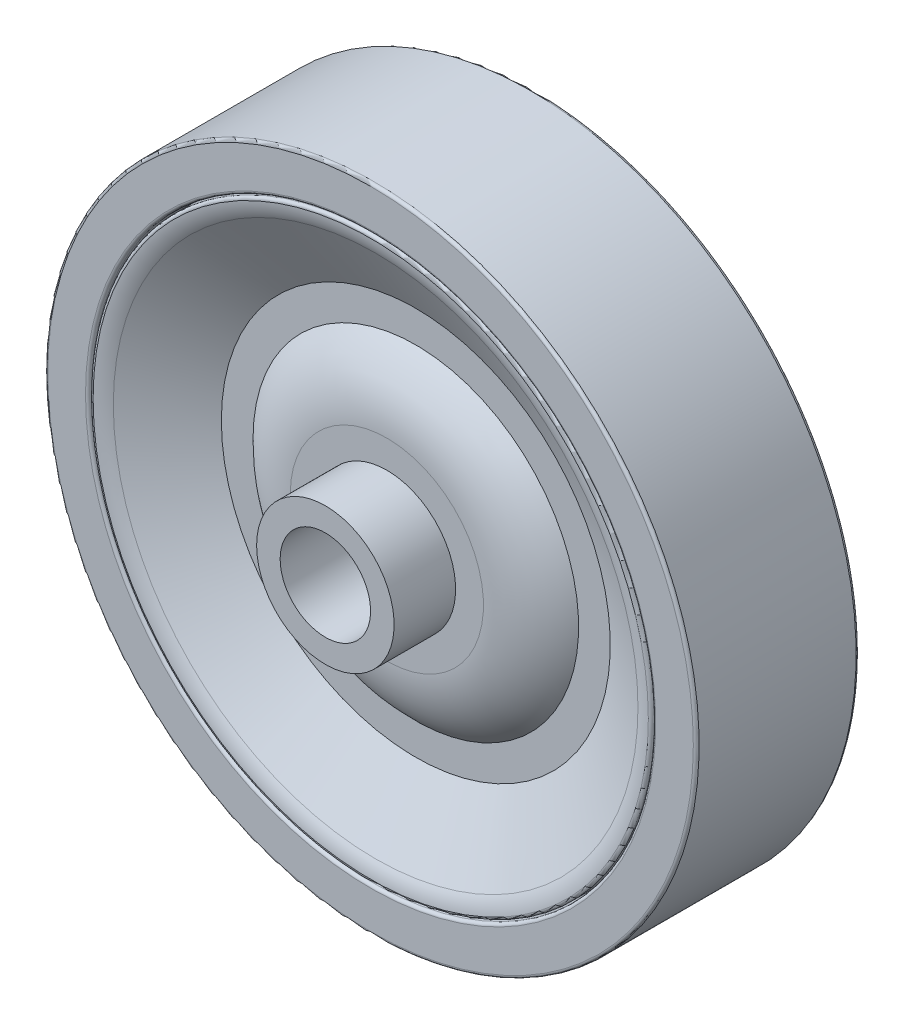
from build123d import *

# Parameters (mm, degrees)
FILLET1_R               = 0.254
CUT_EXTRUDE1_DEPTH      = 45.343566836
CUT_EXTRUDE1_DEPTH_BACK = 45.343566836
SKETCH2_R               = 24.765
SKETCH2_R_2             = 24.638


with BuildPart() as part:
    # Sketch1 → Revolve1 (revolve)
    with BuildSketch(Plane(origin=(0, 0, 0), x_dir=(0, 0, -1), z_dir=(1, 0, 0))):
        with BuildLine():
            Line((0, 28.575), (7.14375, 28.575))
            Line((7.14375, 28.575), (7.14375, 24.765))
            Line((7.14375, 24.765), (4.60375, 24.765))
            Line((4.60375, 24.765), (4.60375, 24.638))
            Line((4.60375, 24.638), (7.14375, 24.638))
            ThreePointArc((7.14375, 24.638), (7.031004143, 23.799415143), (6.700773898, 23.020387432))
            Line((6.700773898, 23.020387432), (3.175, 17.065625))
            Line((3.175, 17.065625), (3.175, 14.2875))
            ThreePointArc((3.175, 14.2875), (5.05226622, 11.647141084), (5.715, 8.475957141))
            Line((5.715, 8.475957141), (5.715, 6.0325))
            Line((5.715, 6.0325), (11.1125, 6.0325))
            Line((11.1125, 6.0325), (11.1125, 3.96875))
            Line((11.1125, 3.96875), (0, 3.96875))
            Line((0, 3.96875), (0, 28.575))
        make_face()
    revolve(axis=Axis((0, 0, -11.1125), (0, 0, 1)))

    # Fillet1
    fillet1_edges = [part.edges().sort_by_distance(p)[0] for p in [
        (0, -28.575, -7.14375),
        (0, -24.765, -7.14375),
        (0, -24.638, -7.14375),
    ]]
    fillet(fillet1_edges, radius=FILLET1_R)

    # Mirror1: part across plane


with BuildPart() as part_1:
    add(part.part)
    add(part.part.mirror(Plane.XY))

    # Sketch2 → Cut-Extrude1 (cut, two sides: drawn at the far end of the back side and taken through both)
    with BuildSketch(Plane.XY.offset(7.14375).offset(-CUT_EXTRUDE1_DEPTH_BACK)):
        Circle(SKETCH2_R)
        Circle(SKETCH2_R_2, mode=Mode.SUBTRACT)
    extrude(amount=CUT_EXTRUDE1_DEPTH + CUT_EXTRUDE1_DEPTH_BACK, mode=Mode.SUBTRACT)


with BuildPart() as cut_extrude1_piece_1:
    # of the separate pieces the step leaves, piece 1, a body of its own (cut_extrude1_pieces)
    add(part_1.part.solids().sort_by_distance((0, 24.638, -6.878685566))[0])


with BuildPart() as cut_extrude1_piece_2:
    # of the separate pieces the step leaves, piece 2, a body of its own (cut_extrude1_pieces)
    add(part_1.part.solids().sort_by_distance((0, 28.575, -6.88975))[0])


solid = Compound([cut_extrude1_piece_1.part, cut_extrude1_piece_2.part])
